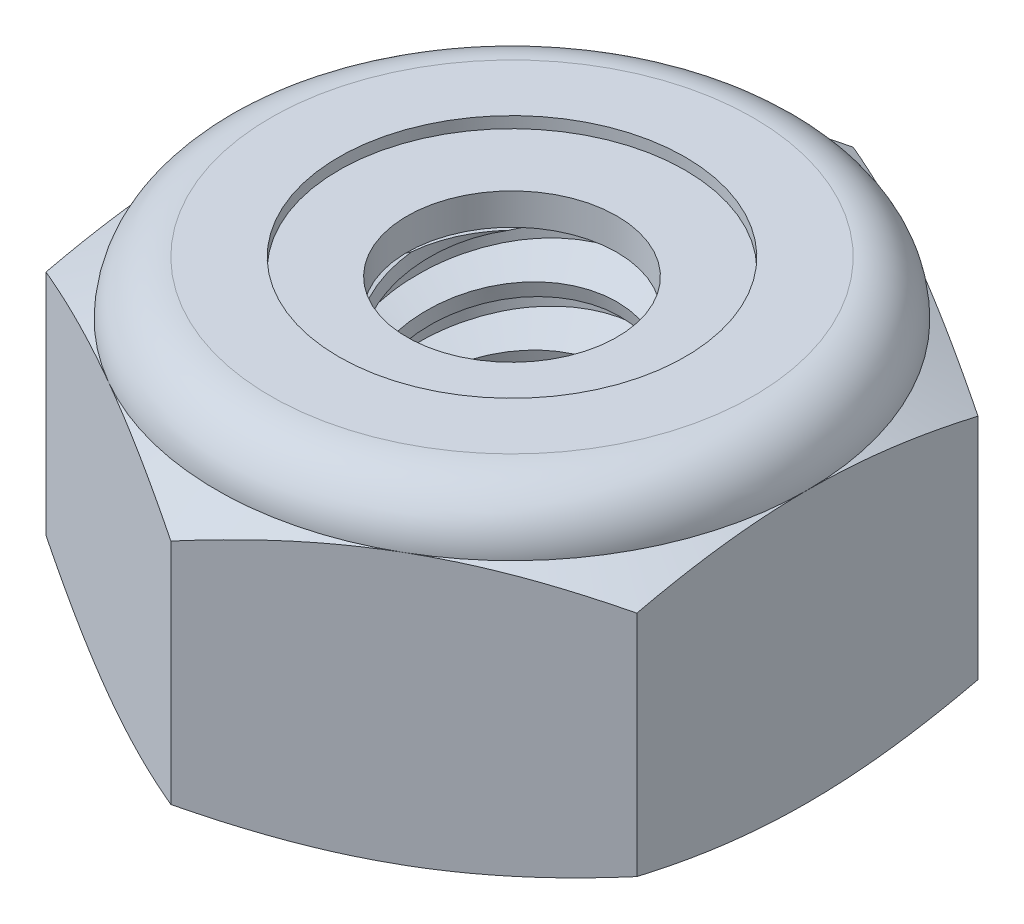
from build123d import *

# Parameters (mm, degrees)
EXTRUDE1_DEPTH       = 4.365625
SKETCH2_W            = 1.7526
SKETCH2_H            = 4.365625
LPATTERN1_COUNT      = 6
LPATTERN1_PITCH      = 0.79375
LPATTERN1_COUNT_DIR2 = 2
LPATTERN1_PITCH_DIR2 = 0.79375


with BuildPart() as part:
    # Sketch1 → Extrude1 (new body)
    with BuildSketch(Plane(origin=(0, 0, 0), x_dir=(1, 0, 0), z_dir=(0, 1, 0))):
        Polygon((0, 4.582717762), (-3.96875, 2.291358881), (-3.96875, -2.291358881), (0, -4.582717762), (3.96875, -2.291358881), (3.96875, 2.291358881), align=None)
    extrude(amount=EXTRUDE1_DEPTH)

    # Sketch4 → Cut-Revolve2 (revolve, cut)
    with BuildSketch(Plane(origin=(0, 0, 0), x_dir=(0, 0, -1), z_dir=(1, 0, 0))):
        Polygon((0, 4.365625), (1.7526, 4.365625), (1.410275607, 4.205996514), (1.410275607, 0.159628486), (1.7526, 0), (0, 0), align=None)
    revolve(axis=Axis((0, 4.365625, 0), (0, 1, 0)), mode=Mode.SUBTRACT)


with BuildPart() as body_2:
    # Sketch2 → Revolve1 (revolve)
    with BuildSketch(Plane(origin=(0, 0, 0), x_dir=(0, 0, -1), z_dir=(1, 0, 0))):
        with Locations((0.8763, 2.1828125)):
            Rectangle(SKETCH2_W, SKETCH2_H)
    revolve(axis=Axis((0, -1.7526, 0), (0, 1, 0)))

    # Sketch3 → Cut-Revolve1 (revolve, cut)
    with BuildSketch(Plane(origin=(0, 0, 0), x_dir=(0, 0, -1), z_dir=(1, 0, 0))):
        Polygon((1.774513192, 4.268856346), (1.927905533, 3.591475768), (1.454101991, 3.7385105), (1.410275607, 3.932047808), align=None)
    cut_revolve1 = revolve(axis=Axis((0, 4.365625, 0.193538035), (0, -0.975306118536993, -0.22085736379913826)), mode=Mode.SUBTRACT)

    # LPattern1: Cut-Revolve1 6 × 2
    with Locations(*[Vector(0, -1, 0) * (i * LPATTERN1_PITCH) + Vector(0, 1, 0) * (j * LPATTERN1_PITCH_DIR2) for i in range(LPATTERN1_COUNT) for j in range(LPATTERN1_COUNT_DIR2) if (i, j) != (0, 0)]):
        add(cut_revolve1, mode=Mode.SUBTRACT)


with BuildPart() as part_1:
    add(part.part)

    # Combine1: cut body 2
    add(body_2.part, mode=Mode.SUBTRACT)

    # Sketch5 → Cut-Revolve3 (revolve, cut)
    with BuildSketch(Plane(origin=(0, 0, 0), x_dir=(0, 0, -1), z_dir=(1, 0, 0))):
        with BuildLine():
            Line((0, 0), (3.96875, 0))
            Line((3.96875, 0), (4.582717762, 0.286297869))
            Line((4.582717762, 0.286297869), (4.582717762, 3.351722964))
            Line((4.582717762, 3.351722964), (3.96875, 3.638020833))
            ThreePointArc((3.96875, 3.638020833), (3.755639674, 4.152514674), (3.241145833, 4.365625))
            Line((3.241145833, 4.365625), (3.241145833, 5.635625))
            Line((3.241145833, 5.635625), (5.852717762, 5.635625))
            Line((5.852717762, 5.635625), (5.852717762, -1.27))
            Line((5.852717762, -1.27), (0, -1.27))
            Line((0, -1.27), (0, 0))
        make_face()
    revolve(axis=Axis((0, 0, 0), (0, 1, 0)), mode=Mode.SUBTRACT)

    # Sketch6 → Cut-Revolve4 (revolve, cut)
    with BuildSketch(Plane(origin=(0, 0, 0), x_dir=(0, 0, -1), z_dir=(1, 0, 0))):
        with BuildLine():
            Line((0, 3.638020833), (3.81635, 3.638020833))
            ThreePointArc((3.81635, 3.638020833), (3.6478766, 4.0447516), (3.241145833, 4.213225))
            Line((3.241145833, 4.213225), (2.32571072, 4.213225))
            Line((2.32571072, 4.213225), (2.32571072, 5.635625))
            Line((2.32571072, 5.635625), (0, 5.635625))
            Line((0, 5.635625), (0, 3.638020833))
        make_face()
    revolve(axis=Axis((0, 5.635625, 0), (0, 1, 0)), mode=Mode.SUBTRACT)


with BuildPart() as body_2_2:
    # Sketch7 → Revolve2 (revolve)
    with BuildSketch(Plane(origin=(0, 0, 0), x_dir=(0, 0, -1), z_dir=(1, 0, 0))):
        with BuildLine():
            Line((1.410275607, 3.714220833), (3.734297654, 3.714220833))
            ThreePointArc((3.734297654, 3.714220833), (3.565938876, 4.016854092), (3.241145833, 4.137025))
            Line((3.241145833, 4.137025), (1.410275607, 4.137025))
            Line((1.410275607, 4.137025), (1.410275607, 3.714220833))
        make_face()
    revolve(axis=Axis((0, 3.714220833, 0), (0, 1, 0)))


solid = Compound([part_1.part, body_2_2.part])
